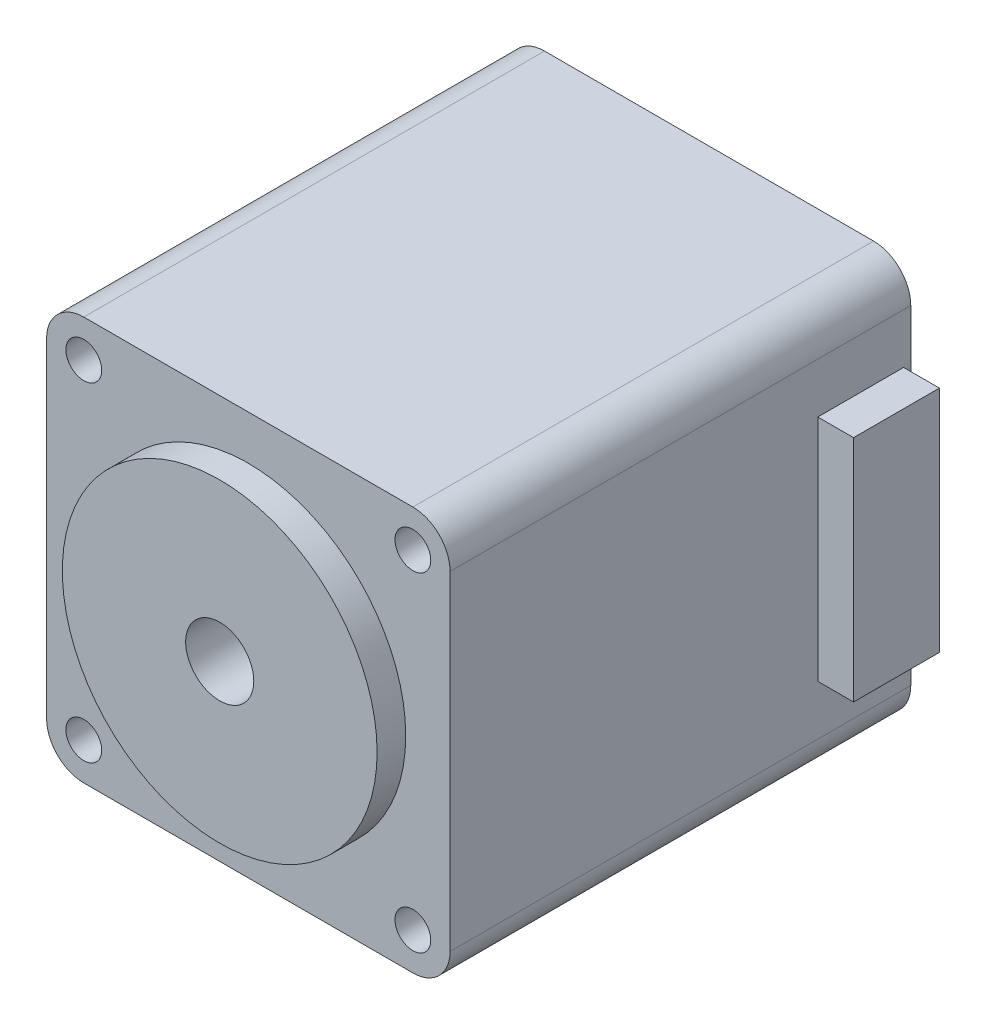
from build123d import *

# Parameters (mm, degrees)
SKETCH1_R           = 2.38
BOSS_EXTRUDE1_DEPTH = 32.2
BOSS_EXTRUDE2_START = 0.5
SKETCH1_3_W         = 2.5
SKETCH1_3_H         = 16
BOSS_EXTRUDE2_DEPTH = 6
CUT_EXTRUDE1_START  = 32.2
SKETCH1_4_R         = 1.25
CUT_EXTRUDE1_DEPTH  = 2
BOSS_EXTRUDE3_START = 32.2
SKETCH1_5_R         = 11
SKETCH1_5_R_2       = 2.38
BOSS_EXTRUDE3_DEPTH = 2


with BuildPart() as part:
    # Sketch1 → Boss-Extrude1 (new body)
    with BuildSketch(Plane.XY):
        with BuildLine():
            Line((11.5, 14.1), (-11.5, 14.1))
            ThreePointArc((-11.5, 14.1), (-13.338477631, 13.338477631), (-14.1, 11.5))
            Line((-14.1, 11.5), (-14.1, -11.5))
            ThreePointArc((-14.1, -11.5), (-13.338477631, -13.338477631), (-11.5, -14.1))
            Line((-11.5, -14.1), (11.5, -14.1))
            ThreePointArc((11.5, -14.1), (13.338477631, -13.338477631), (14.1, -11.5))
            Line((14.1, -11.5), (14.1, 11.5))
            ThreePointArc((14.1, 11.5), (13.338477631, 13.338477631), (11.5, 14.1))
        make_face()
        Circle(SKETCH1_R, mode=Mode.SUBTRACT)
    extrude(amount=BOSS_EXTRUDE1_DEPTH)

    # Sketch1<3> → Boss-Extrude2 (add)
    with BuildSketch(Plane.XY.offset(BOSS_EXTRUDE2_START)):
        with Locations((15.35, 0)):
            Rectangle(SKETCH1_3_W, SKETCH1_3_H)
    extrude(amount=BOSS_EXTRUDE2_DEPTH)

    # Sketch1<4> → Cut-Extrude1 (cut)
    with BuildSketch(Plane.XY.offset(CUT_EXTRUDE1_START)):
        with Locations((-11.5, 11.5)):
            Circle(SKETCH1_4_R)
        with Locations((11.5, 11.5)):
            Circle(SKETCH1_4_R)
        with Locations((11.5, -11.5)):
            Circle(SKETCH1_4_R)
        with Locations((-11.5, -11.5)):
            Circle(SKETCH1_4_R)
    extrude(amount=-CUT_EXTRUDE1_DEPTH, mode=Mode.SUBTRACT)

    # Sketch1<5> → Boss-Extrude3 (add)
    with BuildSketch(Plane.XY.offset(BOSS_EXTRUDE3_START)):
        Circle(SKETCH1_5_R)
        Circle(SKETCH1_5_R_2, mode=Mode.SUBTRACT)
    extrude(amount=BOSS_EXTRUDE3_DEPTH)


solid = part.part
